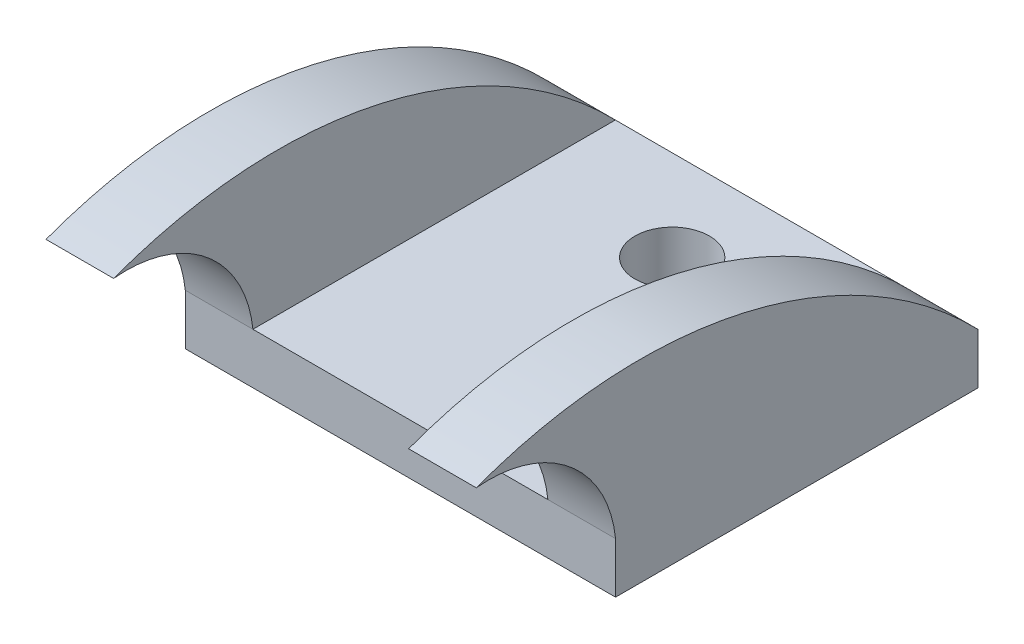
from build123d import *

# Parameters (mm, degrees)
SKETCH1_W            = 40.40124
SKETCH1_H            = 34.036
SKETCH1_R            = 1.257288094
BOSS_EXTRUDE1_DEPTH  = 4.7625
M6_CLEARANCE_HOLE1_D = 7
BOSS_EXTRUDE3_DEPTH  = 6.35


with BuildPart() as part:
    # Sketch1 → Boss-Extrude1 (new body)
    with BuildSketch(Plane(origin=(0, 0, 0), x_dir=(1, 0, 0), z_dir=(0, 1, 0))):
        with Locations((20.20062, 17.018)):
            Rectangle(SKETCH1_W, SKETCH1_H)
        with Locations(Location((20.20062, 25.522416525, 0), (0, 0, 90))):
            Circle(SKETCH1_R, mode=Mode.SUBTRACT)
    extrude(amount=BOSS_EXTRUDE1_DEPTH)

    # M6 Clearance Hole1 (through all)
    with Locations(Plane(origin=(0, 4.7625, 0), x_dir=(1, 0, 0), z_dir=(0, 1, 0))):
        with Locations((20.20062, 25.522416525)):
            Hole(M6_CLEARANCE_HOLE1_D / 2)

    # Sketch5 → Boss-Extrude3 (add)
    with BuildSketch(Plane(origin=(40.40124, 0, 0), x_dir=(0, 0, -1), z_dir=(1, 0, 0))):
        with BuildLine():
            Line((0, 4.7625), (34.036, 4.7625))
            ThreePointArc((34.036, 4.7625), (12.064122693, 17.098372866), (-13.078907049, 15.43548166))
            ThreePointArc((-13.078907049, 15.43548166), (-4.343178895, 12.790354185), (0, 4.7625))
        make_face()
    boss_extrude3 = extrude(amount=-BOSS_EXTRUDE3_DEPTH)

    # Mirror1: Boss-Extrude3 across plane
    add(boss_extrude3.mirror(Plane(origin=(20.20062, 0, 0), x_dir=(0, 0, 1), z_dir=(1, 0, 0))))


solid = part.part
